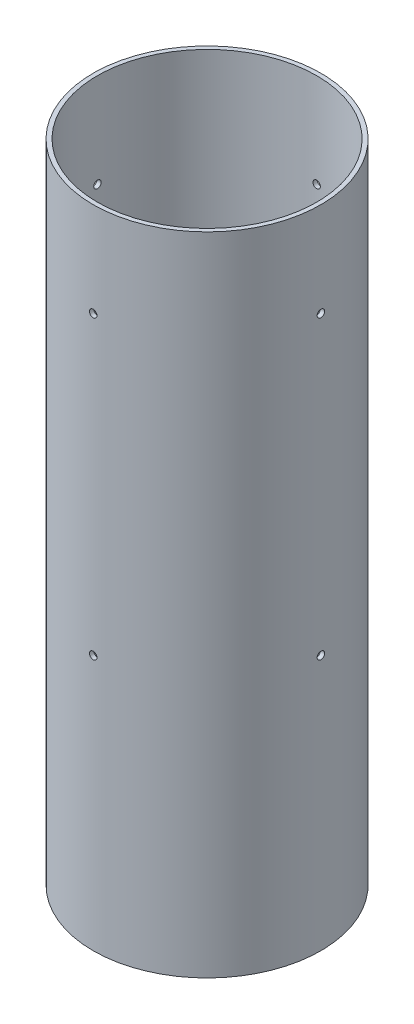
from build123d import *

# Parameters (mm, degrees)
SKETCH1_R               = 53.721
SKETCH1_R_2             = 51.7271
BOSS_EXTRUDE1_DEPTH     = 304.8
SKETCH2_R               = 1.7526
BULKHEAD_HOLES_DEPTH    = 127
CIRPATTERN1_COUNT       = 4
CUT_EXTRUDE1_REACH      = 329.617
CUT_EXTRUDE1_END_RADIUS = 51.7271
SKETCH3_R               = 1.7526
CIRPATTERN2_COUNT       = 4


with BuildPart() as part:
    # Sketch1 → Boss-Extrude1 (new body)
    with BuildSketch(Plane(origin=(0, 0, 0), x_dir=(1, 0, 0), z_dir=(0, 1, 0))):
        with Locations(Location((0, 0, 0), (0, 0, 90))):
            Circle(SKETCH1_R)
        with Locations(Location((0, 0, 0), (0, 0, 90))):
            Circle(SKETCH1_R_2, mode=Mode.SUBTRACT)
    extrude(amount=BOSS_EXTRUDE1_DEPTH)

    # Sketch2 → Bulkhead Holes (cut)
    with BuildSketch(Plane.XY):
        with Locations(Location((0, 120.65, 0), (0, 0, 90))):
            Circle(SKETCH2_R)
    bulkhead_holes = extrude(amount=-BULKHEAD_HOLES_DEPTH, mode=Mode.SUBTRACT)

    # CirPattern1: Bulkhead Holes ×4 about axis
    cirpattern1_axis = Axis((0, 304.8, 0), (0, -1, 0))
    for i in range(1, CIRPATTERN1_COUNT):
        add(bulkhead_holes.rotate(cirpattern1_axis, i * 360 / CIRPATTERN1_COUNT), mode=Mode.SUBTRACT)

    # Cut-Extrude1: up to this cylinder (the profile starts outside it)
    cut_extrude1_end = Plane(origin=(0, 260.35, 0), z_dir=(0, -1, 0)) * Cylinder(CUT_EXTRUDE1_END_RADIUS, 763.6882, mode=Mode.PRIVATE)
    # Sketch3 → Cut-Extrude1 (cut, up to the surface)
    with BuildSketch(Plane(origin=(53.721, 0, 0), x_dir=(0, 0, -1), z_dir=(1, 0, 0)), mode=Mode.PRIVATE) as cut_extrude1_sk1:
        with Locations((0, 260.35)):
            Circle(SKETCH3_R)
    cut_extrude1_tool1 = extrude(cut_extrude1_sk1.sketch, amount=-CUT_EXTRUDE1_REACH, mode=Mode.PRIVATE) - cut_extrude1_end
    cut_extrude1 = cut_extrude1_tool1.solids().sort_by_distance((53.721, 260.35, 0))[0]
    add(cut_extrude1, mode=Mode.SUBTRACT)

    # CirPattern2: Cut-Extrude1 ×4 about axis
    cirpattern2_axis = Axis((0, 304.8, 0), (0, -1, 0))
    for i in range(1, CIRPATTERN2_COUNT):
        add(cut_extrude1.rotate(cirpattern2_axis, i * 360 / CIRPATTERN2_COUNT), mode=Mode.SUBTRACT)


solid = part.part
